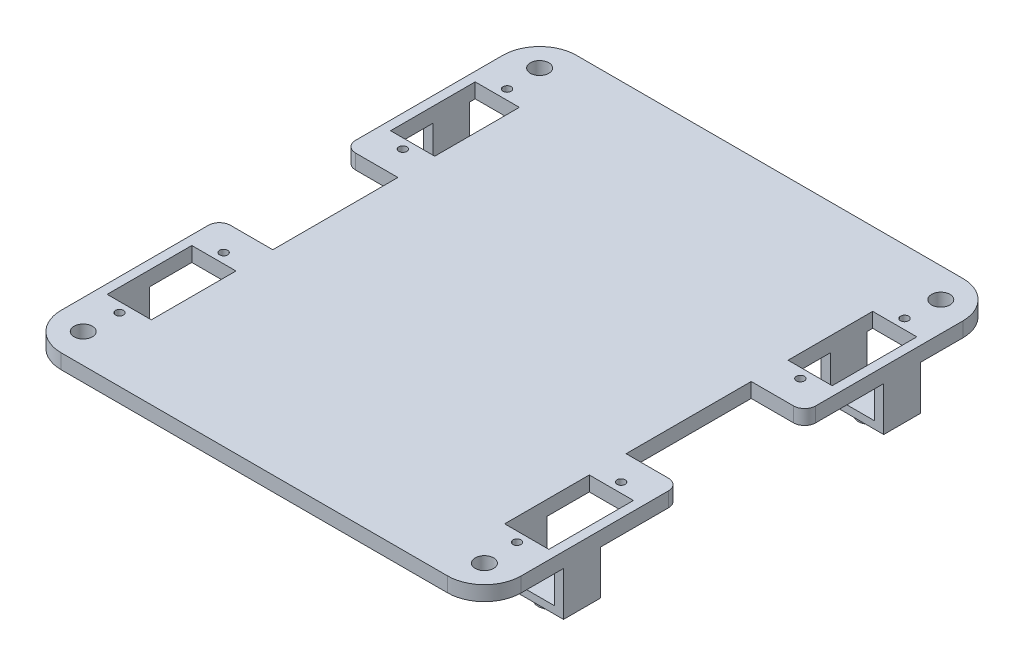
from build123d import *

# Parameters (mm, degrees)
SKETCH1_W           = 120
SKETCH1_H           = 140
BOSS_EXTRUDE1_DEPTH = 4
SKETCH2_W           = 12
SKETCH2_H           = 23
SKETCH2_H_2         = 34
SKETCH2_R           = 1.1
SKETCH2_R_2         = 2.5
CUT_EXTRUDE1_DEPTH  = 93.28217596
SKETCH3_W           = 2.5
SKETCH3_H           = 140
BOSS_EXTRUDE2_DEPTH = 4
SKETCH7_W           = 2.5
SKETCH7_H           = 10
BOSS_EXTRUDE6_DEPTH = 10
SKETCH8_W           = 17
SKETCH8_H           = 10
BOSS_EXTRUDE7_DEPTH = 2
SKETCH9_R           = 3.4
BOSS_EXTRUDE8_DEPTH = 2
SKETCH10_W          = 2.5
SKETCH10_H          = 34
CUT_EXTRUDE2_DEPTH  = 96.552341677
FILLET1_R           = 10
FILLET2_R           = 10
FILLET3_R           = 10
FILLET4_R           = 10
FILLET5_R           = 3
FILLET6_R           = 3
FILLET7_R           = 3
FILLET8_R           = 3


with BuildPart() as part:
    # Sketch1 → Boss-Extrude1 (new body)
    with BuildSketch(Plane(origin=(0, 0, 0), x_dir=(1, 0, 0), z_dir=(0, 1, 0))):
        Rectangle(SKETCH1_W, SKETCH1_H)
    extrude(amount=BOSS_EXTRUDE1_DEPTH)

    # Sketch2 → Cut-Extrude1 (cut, through all)
    with BuildSketch(Plane(origin=(0, 4, 0), x_dir=(1, 0, 0), z_dir=(0, 1, 0))):
        with Locations((54, 38.5)):
            Rectangle(SKETCH2_W, SKETCH2_H)
        with Locations((-54, 38.5)):
            Rectangle(SKETCH2_W, SKETCH2_H)
        with Locations((54, -38.5)):
            Rectangle(SKETCH2_W, SKETCH2_H)
        with Locations((-54, -38.5)):
            Rectangle(SKETCH2_W, SKETCH2_H)
        with Locations((-54, 0)):
            Rectangle(SKETCH2_W, SKETCH2_H_2)
        with Locations((54, 0)):
            Rectangle(SKETCH2_W, SKETCH2_H_2)
        with Locations(Location((-54, 52.65, 0), (0, 0, 270))):
            Circle(SKETCH2_R)
        with Locations(Location((-54, 24.35, 0), (0, 0, 270))):
            Circle(SKETCH2_R)
        with Locations(Location((-54, -24.35, 0), (0, 0, 270))):
            Circle(SKETCH2_R)
        with Locations(Location((-54, -52.65, 0), (0, 0, 270))):
            Circle(SKETCH2_R)
        with Locations(Location((54, 52.65, 0), (0, 0, 270))):
            Circle(SKETCH2_R)
        with Locations(Location((54, 24.35, 0), (0, 0, 270))):
            Circle(SKETCH2_R)
        with Locations(Location((54, -24.35, 0), (0, 0, 270))):
            Circle(SKETCH2_R)
        with Locations(Location((54, -52.65, 0), (0, 0, 270))):
            Circle(SKETCH2_R)
        with Locations(Location((-54.5, 62, 0), (0, 0, 270))):
            Circle(SKETCH2_R_2)
        with Locations(Location((54.5, 62, 0), (0, 0, 270))):
            Circle(SKETCH2_R_2)
        with Locations(Location((54.5, -62, 0), (0, 0, 270))):
            Circle(SKETCH2_R_2)
        with Locations(Location((-54.5, -62, 0), (0, 0, 270))):
            Circle(SKETCH2_R_2)
    extrude(amount=-CUT_EXTRUDE1_DEPTH, mode=Mode.SUBTRACT)

    # Sketch3 → Boss-Extrude2 (add)
    with BuildSketch(Plane(origin=(0, 4, 0), x_dir=(1, 0, 0), z_dir=(0, 1, 0))):
        with Locations((61.25, 0)):
            Rectangle(SKETCH3_W, SKETCH3_H)
        with Locations((-61.25, 0)):
            Rectangle(SKETCH3_W, SKETCH3_H)
    extrude(amount=-BOSS_EXTRUDE2_DEPTH)

    # Sketch7 → Boss-Extrude6 (add)
    with BuildSketch(Plane.XZ):
        with Locations((46.75, 43.5)):
            Rectangle(SKETCH7_W, SKETCH7_H)
        with Locations((61.25, 43.5)):
            Rectangle(SKETCH7_W, SKETCH7_H)
        with Locations((-61.25, 43.5)):
            Rectangle(SKETCH7_W, SKETCH7_H)
        with Locations((-46.75, 43.5)):
            Rectangle(SKETCH7_W, SKETCH7_H)
        with Locations((-61.25, -43.5)):
            Rectangle(SKETCH7_W, SKETCH7_H)
        with Locations((-46.75, -43.5)):
            Rectangle(SKETCH7_W, SKETCH7_H)
        with Locations((46.75, -43.5)):
            Rectangle(SKETCH7_W, SKETCH7_H)
        with Locations((61.25, -43.5)):
            Rectangle(SKETCH7_W, SKETCH7_H)
    extrude(amount=BOSS_EXTRUDE6_DEPTH)

    # Sketch8 → Boss-Extrude7 (add)
    with BuildSketch(Plane.XZ.offset(10)):
        with Locations((-54, 43.5)):
            Rectangle(SKETCH8_W, SKETCH8_H)
        with Locations((-54, -43.5)):
            Rectangle(SKETCH8_W, SKETCH8_H)
        with Locations((54, -43.5)):
            Rectangle(SKETCH8_W, SKETCH8_H)
        with Locations((54, 43.5)):
            Rectangle(SKETCH8_W, SKETCH8_H)
    extrude(amount=BOSS_EXTRUDE7_DEPTH)

    # Sketch9 → Boss-Extrude8 (add)
    with BuildSketch(Plane.XZ.offset(12)):
        with Locations(Location((54, 43.5, 0), (0, 0, 270))):
            Circle(SKETCH9_R)
        with Locations(Location((-54, 43.5, 0), (0, 0, 270))):
            Circle(SKETCH9_R)
        with Locations(Location((-54, -43.5, 0), (0, 0, 270))):
            Circle(SKETCH9_R)
        with Locations(Location((54, -43.5, 0), (0, 0, 270))):
            Circle(SKETCH9_R)
    extrude(amount=BOSS_EXTRUDE8_DEPTH)

    # Sketch10 → Cut-Extrude2 (cut, through all)
    with BuildSketch(Plane(origin=(0, 4, 0), x_dir=(1, 0, 0), z_dir=(0, 1, 0))):
        with Locations((61.25, 0)):
            Rectangle(SKETCH10_W, SKETCH10_H)
        with Locations((-61.25, 0)):
            Rectangle(SKETCH10_W, SKETCH10_H)
    extrude(amount=-CUT_EXTRUDE2_DEPTH, mode=Mode.SUBTRACT)

    # Fillet1
    fillet1_edges = [part.edges().sort_by_distance(p)[0] for p in [
        (62.5, 2, -70),
    ]]
    fillet(fillet1_edges, radius=FILLET1_R)

    # Fillet2
    fillet2_edges = [part.edges().sort_by_distance(p)[0] for p in [
        (-62.5, 2, -70),
    ]]
    fillet(fillet2_edges, radius=FILLET2_R)

    # Fillet3
    fillet3_edges = [part.edges().sort_by_distance(p)[0] for p in [
        (-62.5, 2, 70),
    ]]
    fillet(fillet3_edges, radius=FILLET3_R)

    # Fillet4
    fillet4_edges = [part.edges().sort_by_distance(p)[0] for p in [
        (62.5, 2, 70),
    ]]
    fillet(fillet4_edges, radius=FILLET4_R)

    # Fillet5
    fillet5_edges = [part.edges().sort_by_distance(p)[0] for p in [
        (62.5, 2, -17),
    ]]
    fillet(fillet5_edges, radius=FILLET5_R)

    # Fillet6
    fillet6_edges = [part.edges().sort_by_distance(p)[0] for p in [
        (-62.5, 2, 17),
    ]]
    fillet(fillet6_edges, radius=FILLET6_R)

    # Fillet7
    fillet7_edges = [part.edges().sort_by_distance(p)[0] for p in [
        (62.5, 2, 17),
    ]]
    fillet(fillet7_edges, radius=FILLET7_R)

    # Fillet8
    fillet8_edges = [part.edges().sort_by_distance(p)[0] for p in [
        (-62.5, 2, -17),
    ]]
    fillet(fillet8_edges, radius=FILLET8_R)


solid = part.part
